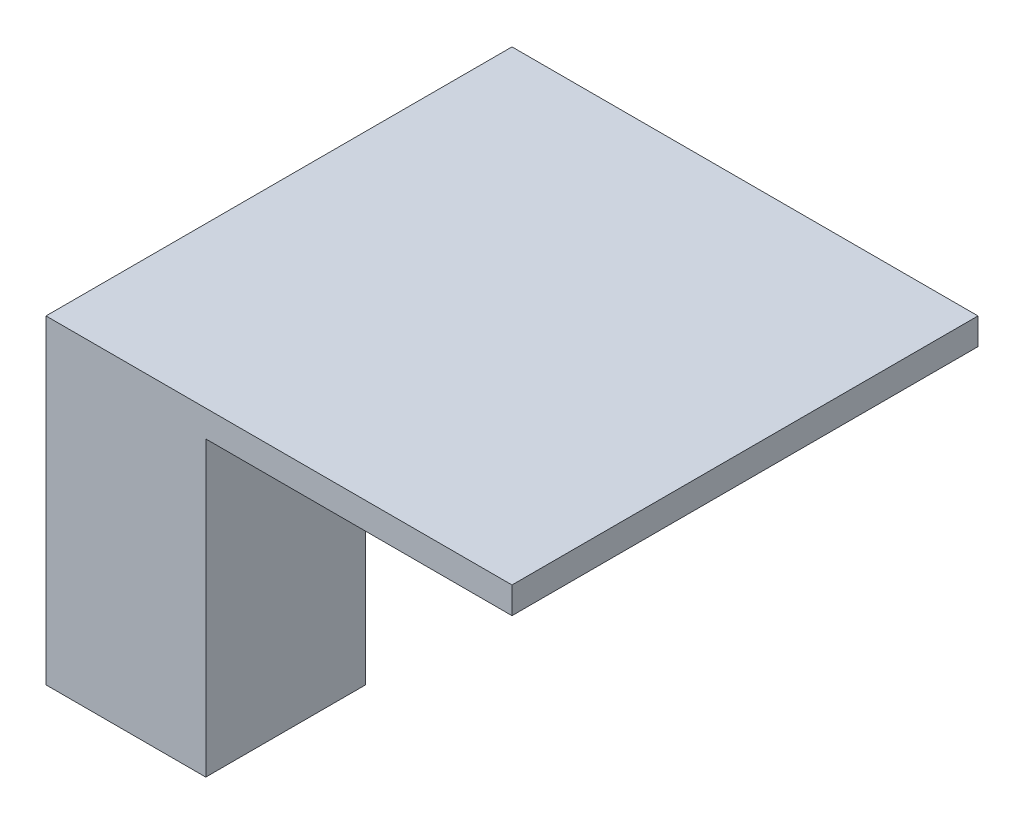
from build123d import *

# Parameters (mm, degrees)
SKETCH1_W           = 12
SKETCH1_H           = 12
BOSS_EXTRUDE1_DEPTH = 22
SKETCH2_W           = 35
SKETCH2_H           = 35
BOSS_EXTRUDE2_DEPTH = 2


with BuildPart() as part:
    # Sketch1 → Boss-Extrude1 (new body)
    with BuildSketch(Plane(origin=(0, 0, 0), x_dir=(1, 0, 0), z_dir=(0, 1, 0))):
        with Locations((6, 6)):
            Rectangle(SKETCH1_W, SKETCH1_H)
    extrude(amount=BOSS_EXTRUDE1_DEPTH)

    # Sketch2 → Boss-Extrude2 (add)
    with BuildSketch(Plane(origin=(0, 22, 0), x_dir=(1, 0, 0), z_dir=(0, 1, 0))):
        with Locations((17.5, 17.5)):
            Rectangle(SKETCH2_W, SKETCH2_H)
    extrude(amount=BOSS_EXTRUDE2_DEPTH)


solid = part.part
